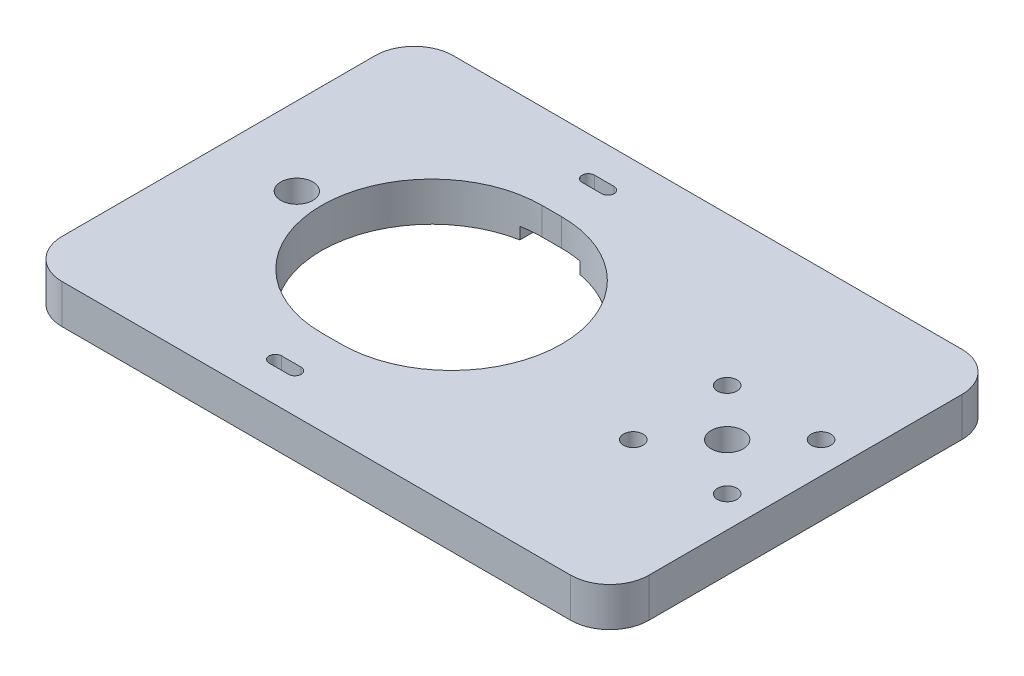
from build123d import *

# Parameters (mm, degrees)
SKETCH_1_R          = 4.1
SKETCH_1_R_2        = 2.5
EXTRUDE_1_DEPTH     = 10
CUT_EXTRUDE_3_REACH = 92.692
CUT_EXTRUDE_START   = 3
CUT_EXTRUDE_4_DEPTH = 3
SKETCH_7_R          = 5.1
CUT_EXTRUDE_5_DEPTH = 5


with BuildPart() as part:
    # ｽｹｯﾁ1 → ﾎﾞｽ - 押し出し1 (new body)
    with BuildSketch(Plane(origin=(0, 0, 0), x_dir=(1, 0, 0), z_dir=(0, 1, 0))):
        with BuildLine():
            Line((-65, -50), (65, -50))
            ThreePointArc((65, -50), (72.071067812, -47.071067812), (75, -40))
            Line((75, -40), (75, 40))
            ThreePointArc((75, 40), (72.071067812, 47.071067812), (65, 50))
            Line((65, 50), (-65, 50))
            ThreePointArc((-65, 50), (-72.071067812, 47.071067812), (-75, 40))
            Line((-75, 40), (-75, -40))
            ThreePointArc((-75, -40), (-72.071067812, -47.071067812), (-65, -50))
        make_face()
        with Locations(Location((55, 0, 0), (0, 0, 270))):
            Circle(SKETCH_1_R, mode=Mode.SUBTRACT)
        with Locations(Location((43, 12, 0), (0, 0, 270))):
            Circle(SKETCH_1_R_2, mode=Mode.SUBTRACT)
        with Locations(Location((67, 12, 0), (0, 0, 270))):
            Circle(SKETCH_1_R_2, mode=Mode.SUBTRACT)
        with Locations(Location((67, -12, 0), (0, 0, 270))):
            Circle(SKETCH_1_R_2, mode=Mode.SUBTRACT)
        with Locations(Location((43, -12, 0), (0, 0, 270))):
            Circle(SKETCH_1_R_2, mode=Mode.SUBTRACT)
        with Locations(Location((-55, 0, 0), (0, 0, 270))):
            Circle(SKETCH_1_R, mode=Mode.SUBTRACT)
    extrude(amount=EXTRUDE_1_DEPTH)

    # ｽｹｯﾁ5 → ｶｯﾄ - 押し出し3 (cut, up to next)
    with BuildSketch(Plane(origin=(0, 10, 0), x_dir=(1, 0, 0), z_dir=(0, 1, 0)), mode=Mode.PRIVATE) as cut_extrude_3_sk1:
        with BuildLine():
            Line((-20.5, 28.2), (-15.5, 28.2))
            ThreePointArc((-15.5, 28.2), (12.7, 0), (-15.5, -28.2))
            Line((-15.5, -28.2), (-20.5, -28.2))
            ThreePointArc((-20.5, -28.2), (-48.7, 0), (-20.5, 28.2))
        make_face()
    cut_extrude_3_tool1 = extrude(cut_extrude_3_sk1.sketch, amount=-CUT_EXTRUDE_3_REACH, mode=Mode.PRIVATE) & part.part
    # ｽｹｯﾁ5 → ｶｯﾄ - 押し出し3 (cut, up to next)
    with BuildSketch(Plane(origin=(0, 10, 0), x_dir=(1, 0, 0), z_dir=(0, 1, 0)), mode=Mode.PRIVATE) as cut_extrude_3_sk2:
        with BuildLine():
            Line((-20.5, 41.6), (-15.5, 41.6))
            ThreePointArc((-15.5, 41.6), (-13.9, 40), (-15.5, 38.4))
            Line((-15.5, 38.4), (-20.5, 38.4))
            ThreePointArc((-20.5, 38.4), (-22.1, 40), (-20.5, 41.6))
        make_face()
    cut_extrude_3_tool2 = extrude(cut_extrude_3_sk2.sketch, amount=-CUT_EXTRUDE_3_REACH, mode=Mode.PRIVATE) & part.part
    # ｽｹｯﾁ5 → ｶｯﾄ - 押し出し3 (cut, up to next)
    with BuildSketch(Plane(origin=(0, 10, 0), x_dir=(1, 0, 0), z_dir=(0, 1, 0)), mode=Mode.PRIVATE) as cut_extrude_3_sk3:
        with BuildLine():
            Line((-20.5, -38.4), (-15.5, -38.4))
            ThreePointArc((-15.5, -38.4), (-13.9, -40), (-15.5, -41.6))
            Line((-15.5, -41.6), (-20.5, -41.6))
            ThreePointArc((-20.5, -41.6), (-22.1, -40), (-20.5, -38.4))
        make_face()
    cut_extrude_3_tool3 = extrude(cut_extrude_3_sk3.sketch, amount=-CUT_EXTRUDE_3_REACH, mode=Mode.PRIVATE) & part.part
    add(cut_extrude_3_tool1.solids().sort_by_distance((-18, 10, 0))[0], mode=Mode.SUBTRACT)
    add(cut_extrude_3_tool2.solids().sort_by_distance((-18, 10, -40))[0], mode=Mode.SUBTRACT)
    add(cut_extrude_3_tool3.solids().sort_by_distance((-18, 10, 40))[0], mode=Mode.SUBTRACT)

    # ｽｹｯﾁ6 → ｶｯﾄ - 押し出し4 (cut)
    with BuildSketch(Plane(origin=(0, 0, 0), x_dir=(1, 0, 0), z_dir=(0, 1, 0)).offset(CUT_EXTRUDE_START)):
        with BuildLine():
            Line((-20.5, 45.2), (-15.5, 45.2))
            ThreePointArc((-15.5, 45.2), (-11.823044738, 43.676955262), (-10.3, 40))
            Line((-10.3, 40), (-10.3, 27.716421125))
            ThreePointArc((-10.3, 27.716421125), (12.7, 0), (-10.3, -27.716421125))
            Line((-10.3, -27.716421125), (-10.3, -40))
            ThreePointArc((-10.3, -40), (-11.823044738, -43.676955262), (-15.5, -45.2))
            Line((-15.5, -45.2), (-20.5, -45.2))
            ThreePointArc((-20.5, -45.2), (-24.176955262, -43.676955262), (-25.7, -40))
            Line((-25.7, -40), (-25.7, -27.716421125))
            ThreePointArc((-25.7, -27.716421125), (-48.7, 0), (-25.7, 27.716421125))
            Line((-25.7, 27.716421125), (-25.7, 40))
            ThreePointArc((-25.7, 40), (-24.176955262, 43.676955262), (-20.5, 45.2))
        make_face()
    extrude(amount=-CUT_EXTRUDE_4_DEPTH, mode=Mode.SUBTRACT)

    # ｽｹｯﾁ7 → ｶｯﾄ - 押し出し5 (cut)
    with BuildSketch(Plane.XZ):
        with Locations(Location((20, 0, 0), (0, 0, 270))):
            Circle(SKETCH_7_R)
    extrude(amount=-CUT_EXTRUDE_5_DEPTH, mode=Mode.SUBTRACT)


solid = part.part
